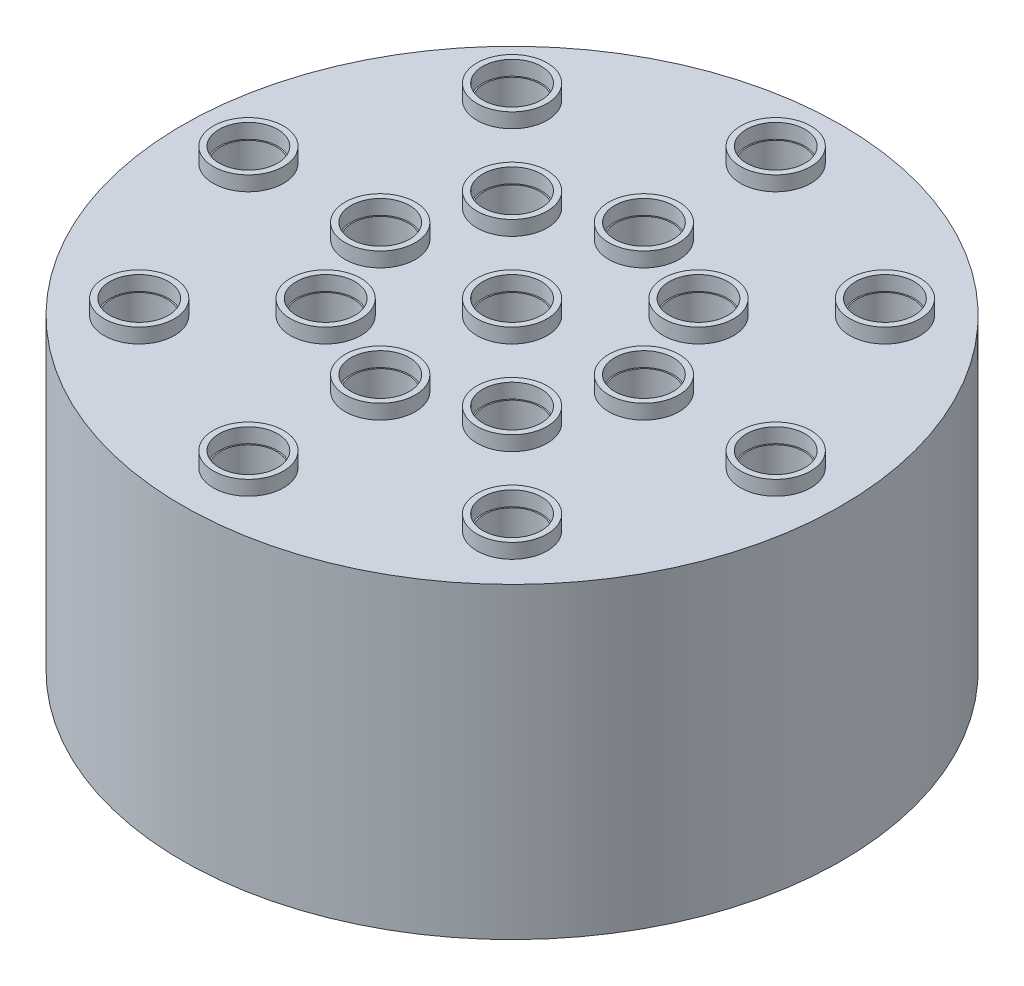
from build123d import *

# Parameters (mm, degrees)
SKETCH2_R            = 45
BOSS_EXTRUDE1_DEPTH  = 42
SKETCH6_R            = 3.825
CUT_EXTRUDE1_DEPTH   = 16
SKETCH10_R           = 4.796352712
BOSS_EXTRUDE2_DEPTH  = 2
SKETCH11_R           = 4
CUT_EXTRUDE2_DEPTH   = 2
LPATTERN1_COUNT      = 3
LPATTERN1_PITCH      = 18
LPATTERN1_COUNT_DIR2 = 3
LPATTERN1_PITCH_DIR2 = 18
LPATTERN2_COUNT      = 3
LPATTERN2_PITCH      = 18
LPATTERN2_COL_COUNT  = 3
LPATTERN2_COL_PITCH  = 18
LPATTERN3_COUNT      = 3
LPATTERN3_PITCH      = 18
LPATTERN3_COL_COUNT  = 3
LPATTERN3_COL_PITCH  = 18
LPATTERN4_COUNT      = 3
LPATTERN4_PITCH      = 18
LPATTERN4_COL_COUNT  = 3
LPATTERN4_COL_PITCH  = 18


with BuildPart() as part:
    # Sketch2 → Boss-Extrude1 (new body)
    with BuildSketch(Plane(origin=(0, 0, 0), x_dir=(1, 0, 0), z_dir=(0, 1, 0))):
        with Locations(Location((0, 0, 0), (0, 0, 90))):
            Circle(SKETCH2_R)
    extrude(amount=BOSS_EXTRUDE1_DEPTH)

    # Sketch6 → Cut-Extrude1 (cut)
    with BuildSketch(Plane(origin=(0, 42, 0), x_dir=(1, 0, 0), z_dir=(0, 1, 0))):
        with Locations(Location((0, 0, 0), (0, 0, 270))):
            Circle(SKETCH6_R)
    cut_extrude1 = extrude(amount=-CUT_EXTRUDE1_DEPTH, mode=Mode.SUBTRACT)

    # Sketch9 → CSK for M5 Countersunk Flat Head Screw1 (revolve, cut)
    with BuildSketch(Plane(origin=(0, 26, 0), x_dir=(0, 0, 1), z_dir=(1, 0, 0))):
        Polygon((0, 0), (0, 15.29228064), (2.65, 13.7), (2.65, 2.55), (5.2, 0), align=None)
    csk_for_m5_countersunk_flat_head_screw1 = revolve(axis=Axis((0, 32.35, 0), (0, -1, 0)), mode=Mode.SUBTRACT)

    # Sketch10 → Boss-Extrude2 (add)
    with BuildSketch(Plane(origin=(0, 42, 0), x_dir=(1, 0, 0), z_dir=(0, 1, 0))):
        with Locations(Location((0, 0, 0), (0, 0, 270))):
            Circle(SKETCH10_R)
    boss_extrude2 = extrude(amount=BOSS_EXTRUDE2_DEPTH)

    # Sketch11 → Cut-Extrude2 (cut)
    with BuildSketch(Plane(origin=(0, 44, 0), x_dir=(1, 0, 0), z_dir=(0, 1, 0))):
        with Locations(Location((0, 0, 0), (0, 0, 270))):
            Circle(SKETCH11_R)
    cut_extrude2 = extrude(amount=-CUT_EXTRUDE2_DEPTH, mode=Mode.SUBTRACT)

    # LPattern1: Cut-Extrude1, CSK for M5 Countersunk Flat Head Screw1, Boss-Extrude2, Cut-Extrude2 3 × 3
    with Locations(*[Vector(1, 0, 0) * (i * LPATTERN1_PITCH) + Vector(-1, 0, 0) * (j * LPATTERN1_PITCH_DIR2) for i in range(LPATTERN1_COUNT) for j in range(LPATTERN1_COUNT_DIR2) if (i, j) != (0, 0)]):
        add(cut_extrude1, mode=Mode.SUBTRACT)
        add(csk_for_m5_countersunk_flat_head_screw1, mode=Mode.SUBTRACT)
        add(boss_extrude2)
        add(cut_extrude2, mode=Mode.SUBTRACT)

    # LPattern2: Cut-Extrude1, CSK for M5 Countersunk Flat Head Screw1, Boss-Extrude2, Cut-Extrude2 ×3
    with Locations(*[(0, 0, -i * LPATTERN2_PITCH) for i in range(1, LPATTERN2_COUNT)]):
        add(cut_extrude1, mode=Mode.SUBTRACT)
        add(csk_for_m5_countersunk_flat_head_screw1, mode=Mode.SUBTRACT)
        add(boss_extrude2)
        add(cut_extrude2, mode=Mode.SUBTRACT)

    # LPattern2 col: Cut-Extrude1, CSK for M5 Countersunk Flat Head Screw1, Boss-Extrude2, Cut-Extrude2 ×3
    with Locations(*[(0, 0, i * LPATTERN2_COL_PITCH) for i in range(1, LPATTERN2_COL_COUNT)]):
        add(cut_extrude1, mode=Mode.SUBTRACT)
        add(csk_for_m5_countersunk_flat_head_screw1, mode=Mode.SUBTRACT)
        add(boss_extrude2)
        add(cut_extrude2, mode=Mode.SUBTRACT)

    # LPattern3: Cut-Extrude1, CSK for M5 Countersunk Flat Head Screw1, Boss-Extrude2, Cut-Extrude2 ×3
    with Locations(*[Vector(-0.7071067811865487, 0, 0.7071067811865464) * (i * LPATTERN3_PITCH) for i in range(1, LPATTERN3_COUNT)]):
        add(cut_extrude1, mode=Mode.SUBTRACT)
        add(csk_for_m5_countersunk_flat_head_screw1, mode=Mode.SUBTRACT)
        add(boss_extrude2)
        add(cut_extrude2, mode=Mode.SUBTRACT)

    # LPattern3 col: Cut-Extrude1, CSK for M5 Countersunk Flat Head Screw1, Boss-Extrude2, Cut-Extrude2 ×3
    with Locations(*[Vector(0.7071067811865487, 0, -0.7071067811865464) * (i * LPATTERN3_COL_PITCH) for i in range(1, LPATTERN3_COL_COUNT)]):
        add(cut_extrude1, mode=Mode.SUBTRACT)
        add(csk_for_m5_countersunk_flat_head_screw1, mode=Mode.SUBTRACT)
        add(boss_extrude2)
        add(cut_extrude2, mode=Mode.SUBTRACT)

    # LPattern4: Cut-Extrude1, CSK for M5 Countersunk Flat Head Screw1, Boss-Extrude2, Cut-Extrude2 ×3
    with Locations(*[Vector(0.7071067811865488, 0, 0.7071067811865462) * (i * LPATTERN4_PITCH) for i in range(1, LPATTERN4_COUNT)]):
        add(cut_extrude1, mode=Mode.SUBTRACT)
        add(csk_for_m5_countersunk_flat_head_screw1, mode=Mode.SUBTRACT)
        add(boss_extrude2)
        add(cut_extrude2, mode=Mode.SUBTRACT)

    # LPattern4 col: Cut-Extrude1, CSK for M5 Countersunk Flat Head Screw1, Boss-Extrude2, Cut-Extrude2 ×3
    with Locations(*[Vector(-0.7071067811865488, 0, -0.7071067811865462) * (i * LPATTERN4_COL_PITCH) for i in range(1, LPATTERN4_COL_COUNT)]):
        add(cut_extrude1, mode=Mode.SUBTRACT)
        add(csk_for_m5_countersunk_flat_head_screw1, mode=Mode.SUBTRACT)
        add(boss_extrude2)
        add(cut_extrude2, mode=Mode.SUBTRACT)


solid = part.part
